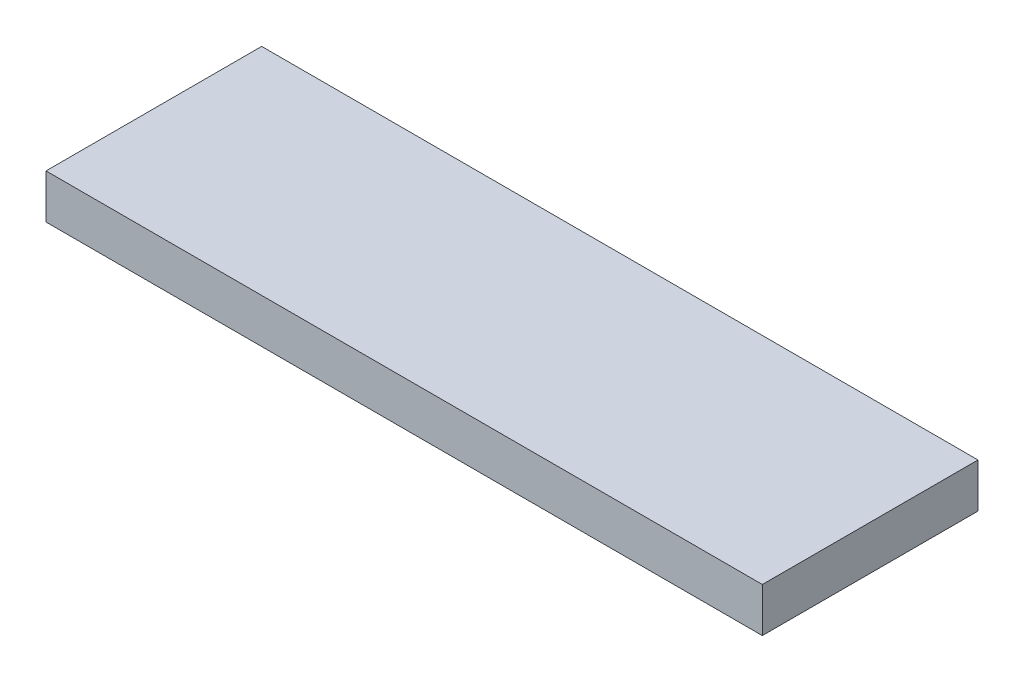
from build123d import *

# Parameters (mm, degrees)
SKETCH1_W           = 295.275
SKETCH1_H           = 88.9
BOSS_EXTRUDE1_DEPTH = 18.25625


with BuildPart() as part:
    # Sketch1 → Boss-Extrude1 (new body)
    with BuildSketch(Plane(origin=(0, 0, 0), x_dir=(1, 0, 0), z_dir=(0, 1, 0))):
        Rectangle(SKETCH1_W, SKETCH1_H)
    extrude(amount=BOSS_EXTRUDE1_DEPTH)


solid = part.part
